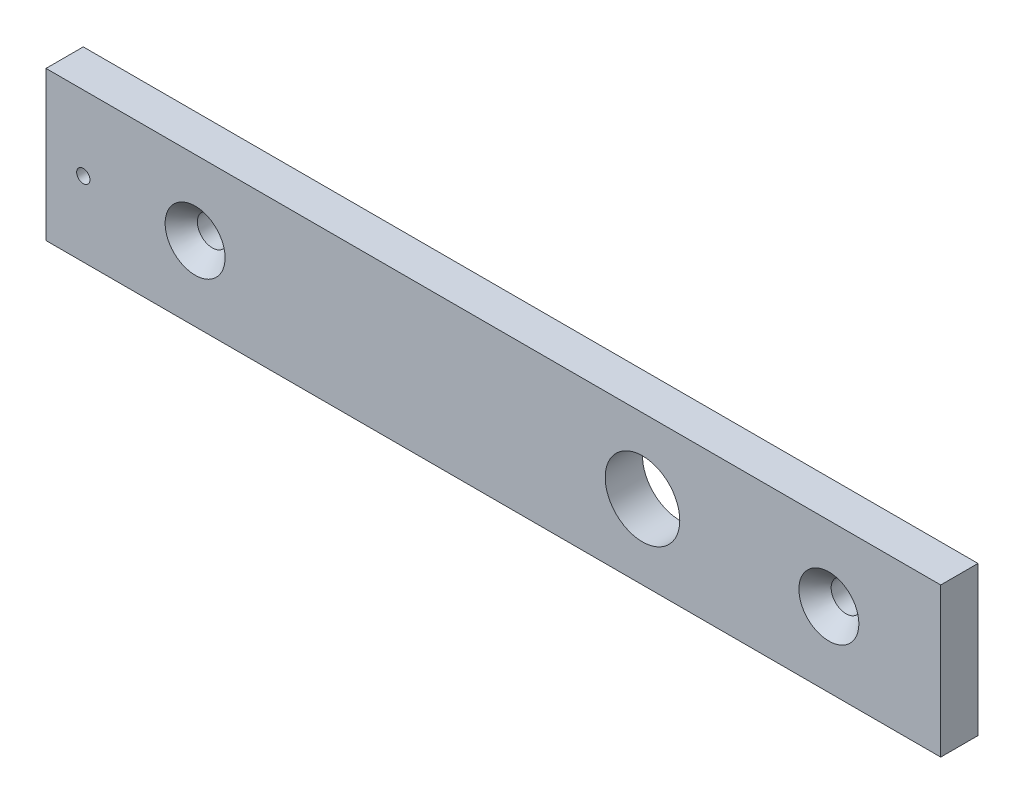
from build123d import *

# Parameters (mm, degrees)
SKETCH1_W                                          = 152.4
SKETCH1_H                                          = 25.4
EXTRUDE1_DEPTH                                     = 6.35
F_4_40_TAPPED_HOLE2_D                              = 2.2606
F_4_40_TAPPED_HOLE2_DEPTH                          = 3.302
F_4_40_TAPPED_HOLE2_TIP                            = 0.679152758
F_1_2_0_5_DIAMETER_HOLE1_D                         = 12.7
CSK_FOR_10_FLAT_HEAD_SOCKET_CAP_SCREW2_D           = 5.1054
CSK_FOR_10_FLAT_HEAD_SOCKET_CAP_SCREW2_CSINK_D     = 10.21334
CSK_FOR_10_FLAT_HEAD_SOCKET_CAP_SCREW2_CSINK_ANGLE = 82
CSK_FOR_10_FLAT_HEAD_SOCKET_CAP_SCREW1_D           = 5.1054
CSK_FOR_10_FLAT_HEAD_SOCKET_CAP_SCREW1_CSINK_D     = 10.21334
CSK_FOR_10_FLAT_HEAD_SOCKET_CAP_SCREW1_CSINK_ANGLE = 82


with BuildPart() as part:
    # Sketch1 → Extrude1 (new body)
    with BuildSketch(Plane.XY):
        Rectangle(SKETCH1_W, SKETCH1_H)
    extrude(amount=EXTRUDE1_DEPTH)

    # #4-40 Tapped Hole2
    with Locations(Plane(origin=(-69.85, 0, 6.35), x_dir=(1, 0, 0), z_dir=(0, 0, 1))):
        with Locations((0, 0)):
            Hole(F_4_40_TAPPED_HOLE2_D / 2, depth=F_4_40_TAPPED_HOLE2_DEPTH)
            with Locations((0, 0, -(F_4_40_TAPPED_HOLE2_DEPTH + F_4_40_TAPPED_HOLE2_TIP / 2))):  # 118° drill point
                Cone(0, F_4_40_TAPPED_HOLE2_D / 2, F_4_40_TAPPED_HOLE2_TIP, mode=Mode.SUBTRACT)

    # 1/2 (0.5) Diameter Hole1 (through all)
    with Locations(Plane(origin=(25.4, 0, 6.35), x_dir=(1, 0, 0), z_dir=(0, 0, 1))):
        with Locations((0, 0)):
            Hole(F_1_2_0_5_DIAMETER_HOLE1_D / 2)

    # CSK for #10 Flat Head Socket Cap Screw2 (through all)
    with Locations(Plane(origin=(-2.296155795, -5.361260674, 6.35), x_dir=(1, 0, 0), z_dir=(0, 0, 1))):
        with Locations((59.446155795, 5.361260674)):
            CounterSinkHole(CSK_FOR_10_FLAT_HEAD_SOCKET_CAP_SCREW2_D / 2, CSK_FOR_10_FLAT_HEAD_SOCKET_CAP_SCREW2_CSINK_D / 2, counter_sink_angle=CSK_FOR_10_FLAT_HEAD_SOCKET_CAP_SCREW2_CSINK_ANGLE)

    # CSK for #10 Flat Head Socket Cap Screw1 (through all)
    with Locations(Plane(origin=(-2.296155795, -5.361260674, 6.35), x_dir=(1, 0, 0), z_dir=(0, 0, 1))):
        with Locations((-48.503844205, 5.361260674)):
            CounterSinkHole(CSK_FOR_10_FLAT_HEAD_SOCKET_CAP_SCREW1_D / 2, CSK_FOR_10_FLAT_HEAD_SOCKET_CAP_SCREW1_CSINK_D / 2, counter_sink_angle=CSK_FOR_10_FLAT_HEAD_SOCKET_CAP_SCREW1_CSINK_ANGLE)


solid = part.part
